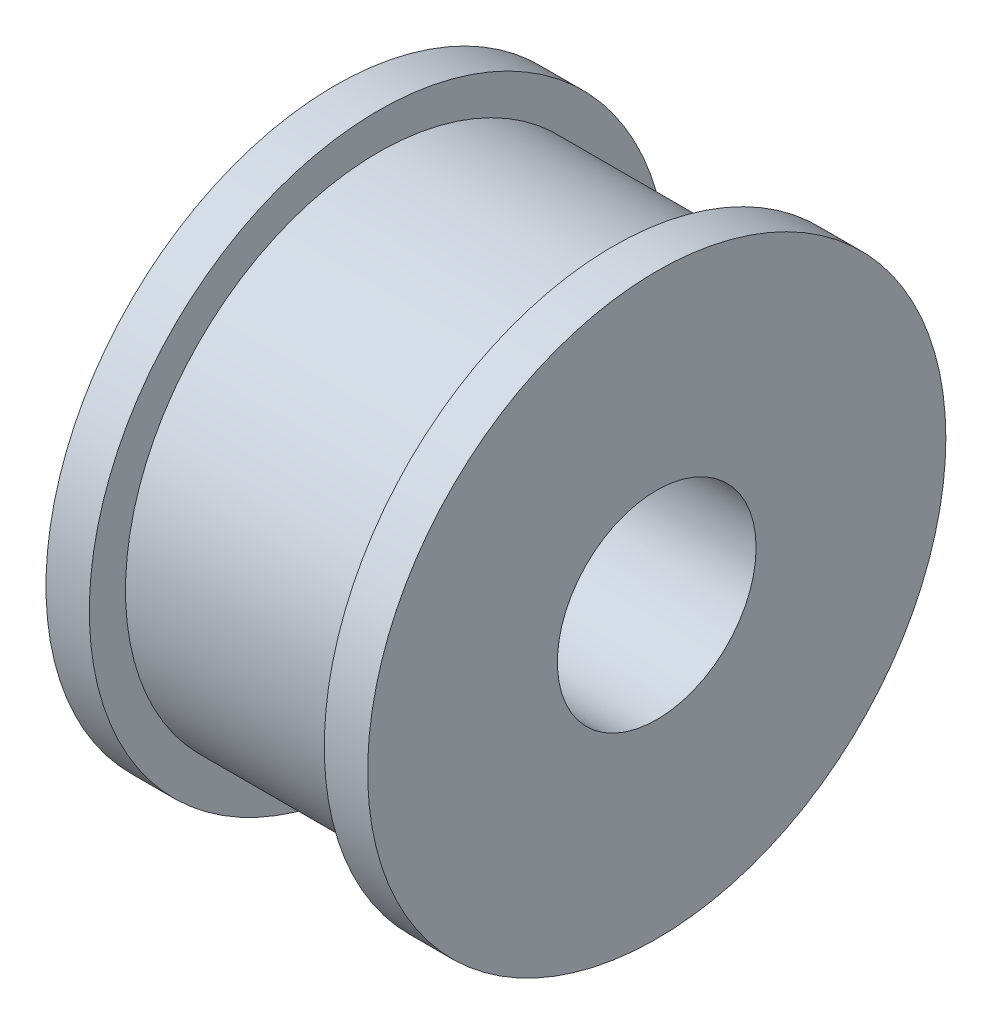
from build123d import *

# Parameters (mm, degrees)
ESQUISSE2_R             = 27.5
ENL_V_MAT_EXTRU_1_DEPTH = 55


with BuildPart() as part:
    # Esquisse1 → Révolution2 (revolve)
    with BuildSketch(Plane(origin=(0, 0, 0), x_dir=(1, 0, 0), z_dir=(0, 1, 0))):
        Polygon((44.5, 0), (-44.5, 0), (-44.5, 80), (-32.5, 80), (-32.5, 70), (32.5, 70), (32.5, 80), (44.5, 80), align=None)
    revolve(axis=Axis((44.5, 0, 0), (-1, 0, 0)))

    # Esquisse2 → Enlèv. mat.-Extru.1 (cut, symmetric)
    with BuildSketch(Plane(origin=(0, 0, 0), x_dir=(0, 0, -1), z_dir=(1, 0, 0))):
        Circle(ESQUISSE2_R)
    extrude(amount=ENL_V_MAT_EXTRU_1_DEPTH, both=True, mode=Mode.SUBTRACT)


solid = part.part
